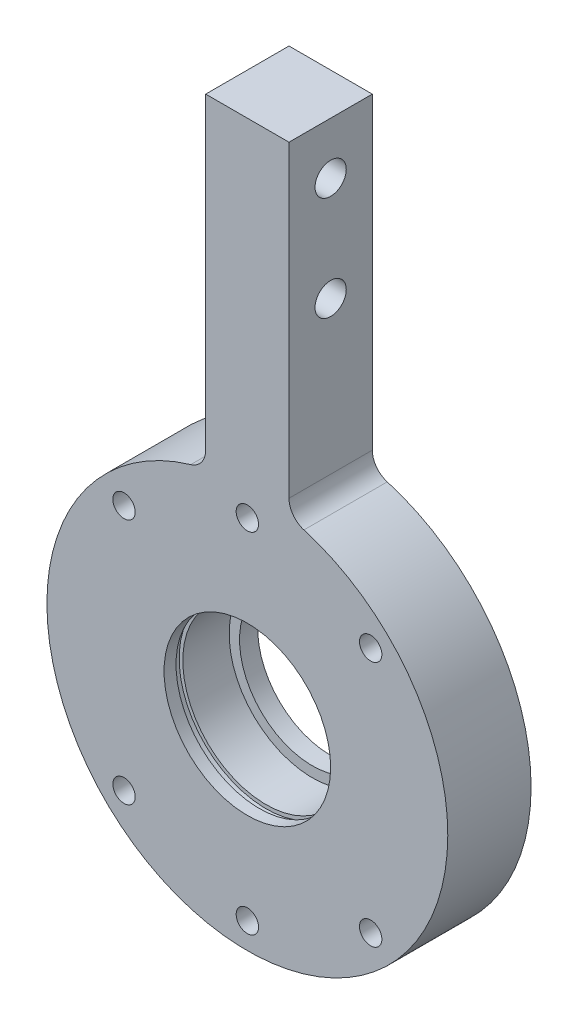
from build123d import *

# Parameters (mm, degrees)
SKETCH1_R           = 38.5
SKETCH1_R_2         = 14
BOSS_EXTRUDE1_DEPTH = 8
SKETCH2_W           = 16
SKETCH2_H           = 62.340339885
BOSS_EXTRUDE2_DEPTH = 8
FILLET1_R           = 4
SKETCH3_W           = 12.5
SKETCH3_H           = 2
SKETCH4_W           = 1.3
SKETCH4_H           = 0.7
SKETCH5_R           = 23
SKETCH5_R_2         = 21
BOSS_EXTRUDE3_DEPTH = 2
SKETCH6_R           = 2.15
CUT_EXTRUDE1_DEPTH  = 109.343204678
CIRPATTERN1_COUNT   = 8
SKETCH7_R           = 3
CUT_EXTRUDE2_DEPTH  = 111.735044137


with BuildPart() as part:
    # Sketch1 → Boss-Extrude1 (new, symmetric)
    with BuildSketch(Plane.XY):
        Circle(SKETCH1_R)
        Circle(SKETCH1_R_2, mode=Mode.SUBTRACT)
    extrude(amount=BOSS_EXTRUDE1_DEPTH, both=True)

    # Sketch2 → Boss-Extrude2 (add, symmetric)
    with BuildSketch(Plane.XY):
        with Locations((0, 68.829830058)):
            Rectangle(SKETCH2_W, SKETCH2_H)
    extrude(amount=BOSS_EXTRUDE2_DEPTH, both=True)

    # Fillet1
    fillet1_edges = [part.edges().sort_by_distance(p)[0] for p in [
        (-8, 37.659660115, 0),
        (8, 37.659660115, 0),
    ]]
    fillet(fillet1_edges, radius=FILLET1_R)

    # Sketch3 → Cut-Revolve1 (revolve, cut)
    with BuildSketch(Plane(origin=(0, 0, 0), x_dir=(0, 0, -1), z_dir=(1, 0, 0)), mode=Mode.PRIVATE) as cut_revolve1_sk:
        with Locations((-1.75, 15)):
            Rectangle(SKETCH3_W, SKETCH3_H)
    revolve(cut_revolve1_sk.sketch.rotate(Axis((0, 0, 0), (0, 0, -1)), 90), axis=Axis((0, 0, 0), (0, 0, -1)), mode=Mode.SUBTRACT)

    # Sketch4 → Cut-Revolve2 (revolve, cut)
    with BuildSketch(Plane(origin=(0, 0, 0), x_dir=(0, 0, -1), z_dir=(1, 0, 0)), mode=Mode.PRIVATE) as cut_revolve2_sk:
        with Locations((-5.05, 16.35)):
            Rectangle(SKETCH4_W, SKETCH4_H)
    revolve(cut_revolve2_sk.sketch.rotate(Axis((0, 0, 0), (0, 0, -1)), 90), axis=Axis((0, 0, 0), (0, 0, -1)), mode=Mode.SUBTRACT)

    # Sketch5 → Boss-Extrude3 (add)
    with BuildSketch(Plane(origin=(0, 0, -8), x_dir=(-1, 0, 0), z_dir=(0, 0, -1))):
        with Locations(Location((0, 0, 0), (0, 0, 180))):
            Circle(SKETCH5_R)
        Circle(SKETCH5_R_2, mode=Mode.SUBTRACT)
    extrude(amount=BOSS_EXTRUDE3_DEPTH)

    # Sketch6 → Cut-Extrude1 (cut, through all)
    with BuildSketch(Plane(origin=(0, 0, -8), x_dir=(-1, 0, 0), z_dir=(0, 0, -1))):
        with Locations((0, 33.5)):
            Circle(SKETCH6_R)
    cut_extrude1 = extrude(amount=-CUT_EXTRUDE1_DEPTH, mode=Mode.SUBTRACT)

    # CirPattern1: Cut-Extrude1 ×8 about axis, 2 skipped
    cirpattern1_axis = Axis((0, 0, 0), (0, 0, 1))
    add([cut_extrude1.rotate(cirpattern1_axis, i * 360 / CIRPATTERN1_COUNT) for i in range(1, CIRPATTERN1_COUNT) if i not in (2, 6)], mode=Mode.SUBTRACT)

    # Sketch7 → Cut-Extrude2 (cut, through all)
    with BuildSketch(Plane(origin=(8, 0, 0), x_dir=(0, 0, -1), z_dir=(1, 0, 0))):
        with Locations(Location((0, 90, 0), (0, 0, 90))):
            Circle(SKETCH7_R)
        with Locations(Location((0, 70, 0), (0, 0, 90))):
            Circle(SKETCH7_R)
    extrude(amount=-CUT_EXTRUDE2_DEPTH, mode=Mode.SUBTRACT)


solid = part.part
